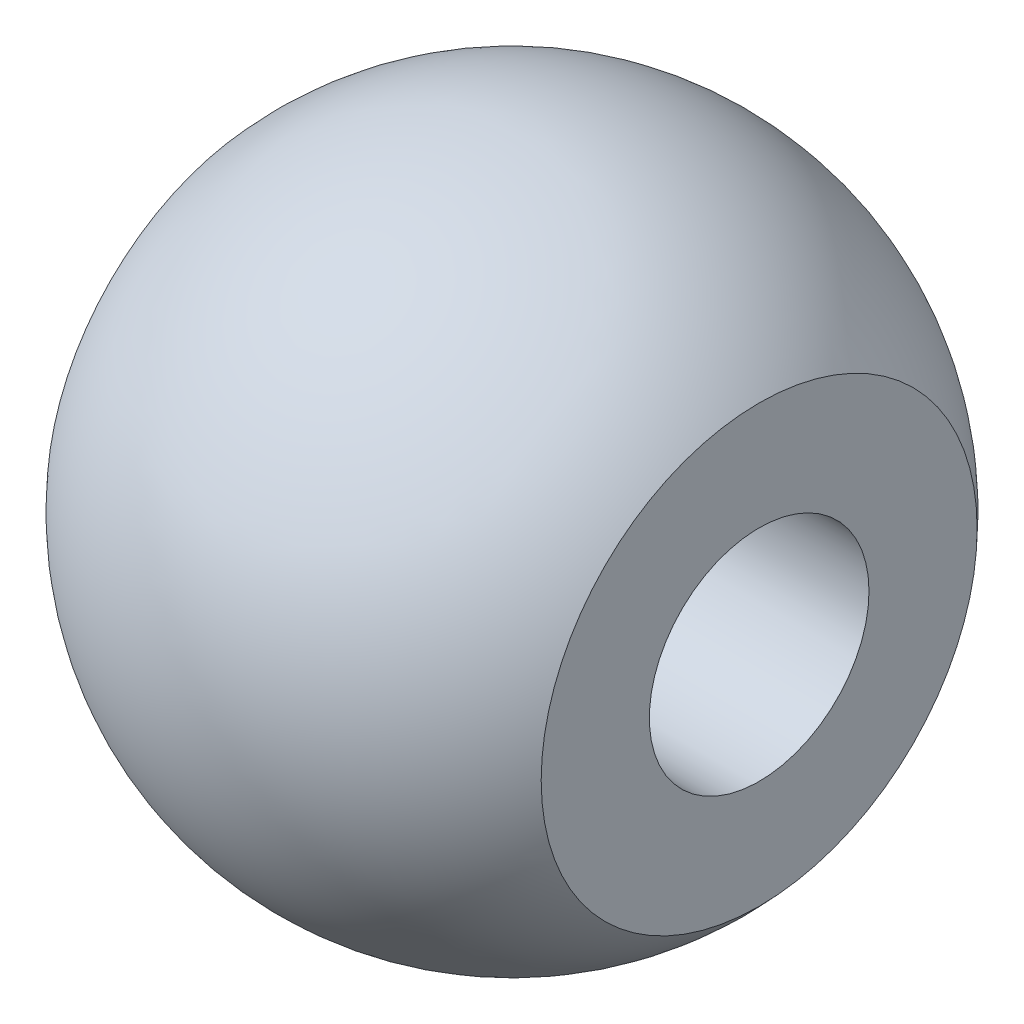
from build123d import *


with BuildPart() as part:
    # Sketch1 → Revolve1 (revolve)
    with BuildSketch(Plane.XY, mode=Mode.PRIVATE) as revolve1_sk:
        with BuildLine():
            Line((9, 3.968626967), (9, 2))
            Line((9, 2), (1, 2))
            Line((1, 2), (0, 3.732050808))
            Line((0, 3.732050808), (0, 3.968626967))
            ThreePointArc((0, 3.968626967), (4.5, 6), (9, 3.968626967))
        make_face()
    revolve(revolve1_sk.sketch.rotate(Axis((9, 0, 0), (-1, 0, 0)), 90), axis=Axis((9, 0, 0), (-1, 0, 0)))


solid = part.part
